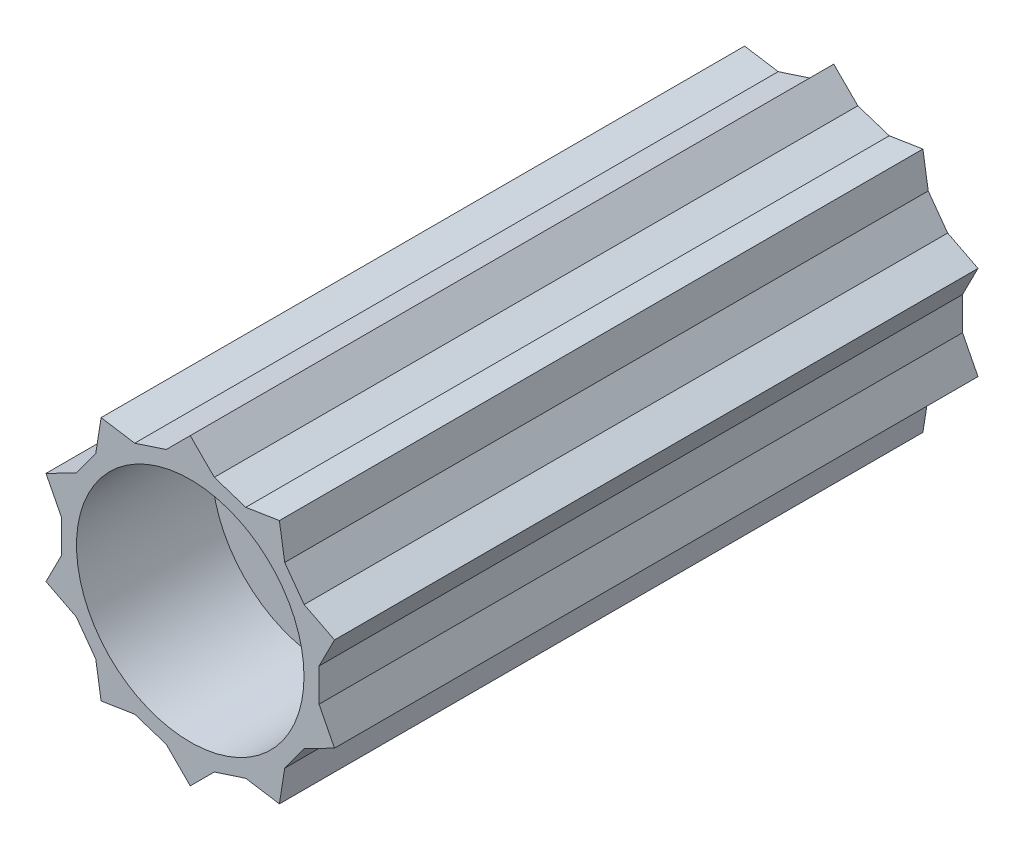
from build123d import *

# Parameters (mm, degrees)
SKETCH2_R           = 22.5
BOSS_EXTRUDE1_DEPTH = 118.8
SKETCH3_R           = 11.25
CUT_EXTRUDE1_DEPTH  = 35
SKETCH4_W           = 6
SKETCH4_H           = 6
CUT_EXTRUDE2_DEPTH  = 35
SKETCH5_R           = 21
CUT_EXTRUDE3_DEPTH  = 25
BOSS_EXTRUDE2_START = -118.8
SKETCH6_R           = 22.5
BOSS_EXTRUDE2_DEPTH = 118.8


with BuildPart() as part:
    # Sketch2 → Boss-Extrude1 (new body)
    with BuildSketch(Plane.XY):
        Circle(SKETCH2_R)
    extrude(amount=BOSS_EXTRUDE1_DEPTH)

    # Sketch3 → Cut-Extrude1 (cut)
    with BuildSketch(Plane(origin=(0, 0, 0), x_dir=(-1, 0, 0), z_dir=(0, 0, -1))):
        Circle(SKETCH3_R)
    extrude(amount=-CUT_EXTRUDE1_DEPTH, mode=Mode.SUBTRACT)

    # Sketch4 → Cut-Extrude2 (cut)
    with BuildSketch(Plane(origin=(0, 0, 0), x_dir=(-1, 0, 0), z_dir=(0, 0, -1))):
        with Locations((0, 13.842624221)):
            Rectangle(SKETCH4_W, SKETCH4_H)
    extrude(amount=-CUT_EXTRUDE2_DEPTH, mode=Mode.SUBTRACT)

    # Sketch5 → Cut-Extrude3 (cut)
    with BuildSketch(Plane.XY.offset(118.8)):
        Circle(SKETCH5_R)
    extrude(amount=-CUT_EXTRUDE3_DEPTH, mode=Mode.SUBTRACT)

    # Sketch6 → Boss-Extrude2 (add)
    with BuildSketch(Plane.XY.offset(118.8).offset(BOSS_EXTRUDE2_START)):
        Polygon((-4.44294699, 23.55705301), (0, 28), (4.44294699, 23.55705301), (10.252068727, 21.66955494), (16.457987064, 22.652475842), (17.440907967, 16.446557506), (21.031142645, 11.505023404), (26.629582456, 8.652475842), (23.777034895, 3.054036032), (23.777034895, -3.054036032), (26.629582456, -8.652475842), (21.031142645, -11.505023404), (17.440907967, -16.446557506), (16.457987064, -22.652475842), (10.252068727, -21.66955494), (4.44294699, -23.55705301), (0, -28), (-4.44294699, -23.55705301), (-10.252068727, -21.66955494), (-16.457987064, -22.652475842), (-17.440907967, -16.446557506), (-21.031142645, -11.505023404), (-26.629582456, -8.652475842), (-23.777034895, -3.054036032), (-23.777034895, 3.054036032), (-26.629582456, 8.652475842), (-21.031142645, 11.505023404), (-17.440907967, 16.446557506), (-16.457987064, 22.652475842), (-10.252068727, 21.66955494), align=None)
        Circle(SKETCH6_R, mode=Mode.SUBTRACT)
    extrude(amount=BOSS_EXTRUDE2_DEPTH)


solid = part.part
